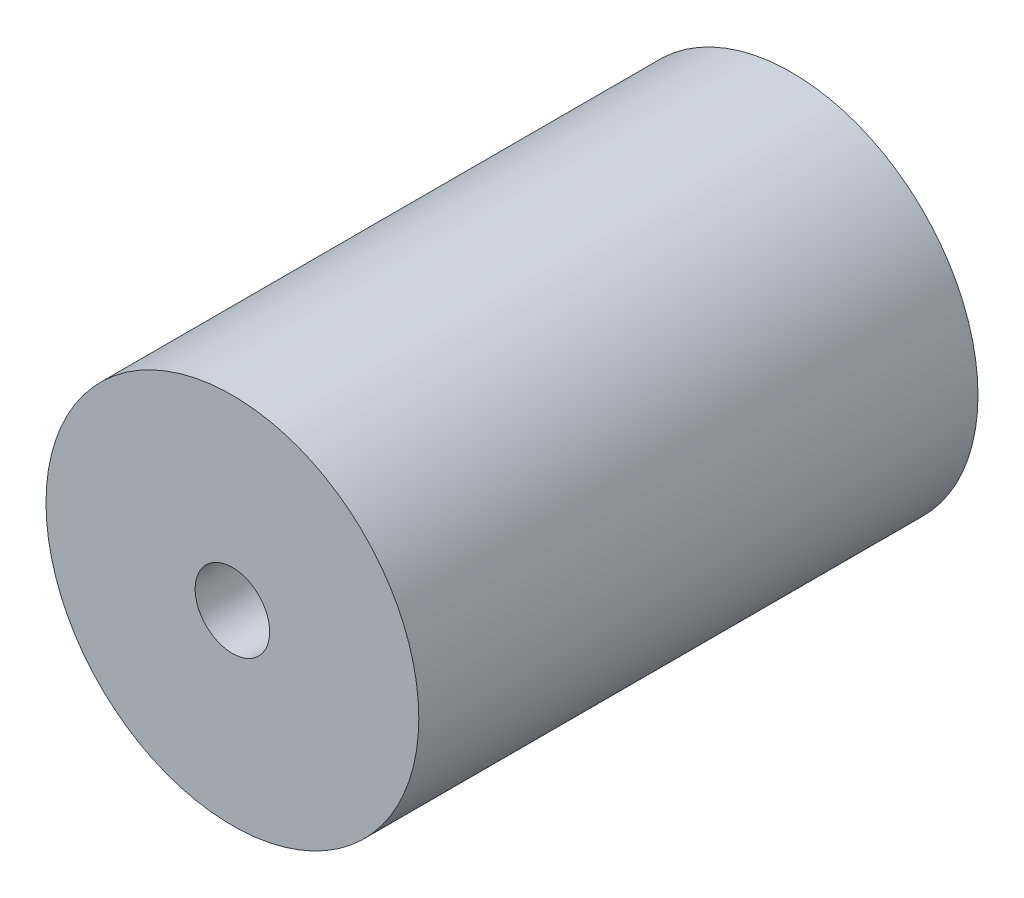
from build123d import *

# Parameters (mm, degrees)
SKICA1_R                 = 20
P_IDAT_VYSUNUT_M1_DEPTH  = 60
SKICA2_R                 = 2.075
ODEBRAT_VYSUNUT_M1_DEPTH = 60
SKICA3_R                 = 4
ODEBRAT_VYSUNUT_M2_DEPTH = 35
ZKOSEN_1_SIZE            = 0.5


with BuildPart() as part:
    # Skica1 → Přidat vysunutím1 (new body)
    with BuildSketch(Plane.XY):
        Circle(SKICA1_R)
    extrude(amount=P_IDAT_VYSUNUT_M1_DEPTH)

    # Skica2 → Odebrat vysunutím1 (cut)
    with BuildSketch(Plane.XY.offset(60)):
        Circle(SKICA2_R)
    extrude(amount=-ODEBRAT_VYSUNUT_M1_DEPTH, mode=Mode.SUBTRACT)

    # Skica3 → Odebrat vysunutím2 (cut)
    with BuildSketch(Plane.XY.offset(60)):
        Circle(SKICA3_R)
    extrude(amount=-ODEBRAT_VYSUNUT_M2_DEPTH, mode=Mode.SUBTRACT)

    # Zkosení1
    zkosen_1_edges = [part.edges().sort_by_distance(p)[0] for p in [
        (-2.075, 0, 25),
    ]]
    chamfer(zkosen_1_edges, length=ZKOSEN_1_SIZE)


solid = part.part
